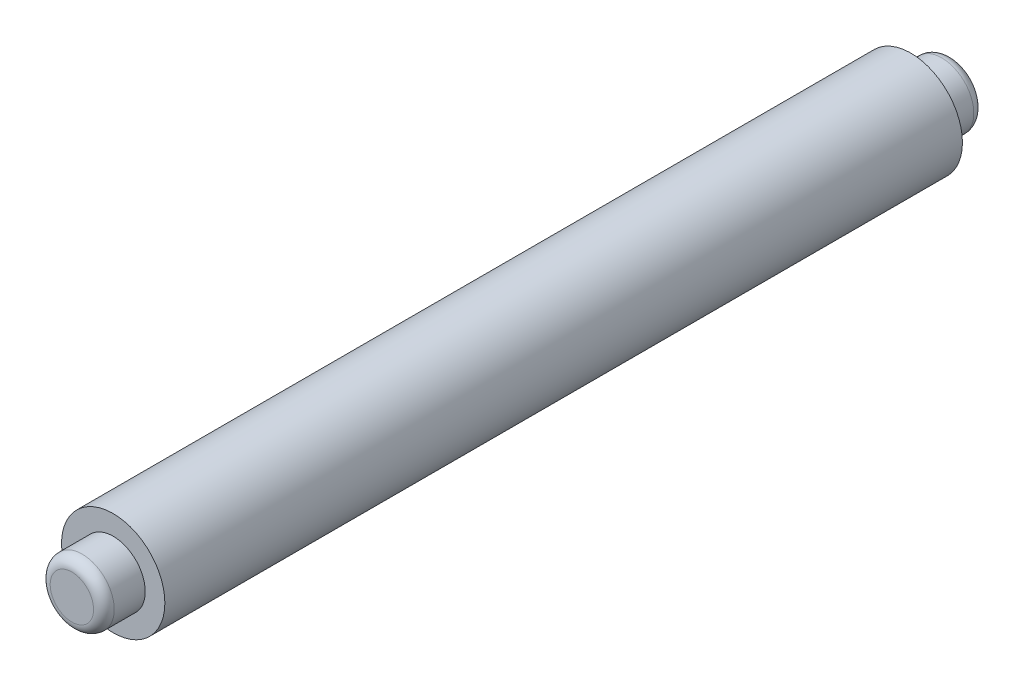
from build123d import *

# Parameters (mm, degrees)
SKETCH1_R           = 2.5
BOSS_EXTRUDE1_DEPTH = 38.61
SKETCH2_R           = 1.55
BOSS_EXTRUDE2_DEPTH = 2
FILLET1_R           = 0.5
BOSS_EXTRUDE3_START = 2
SKETCH3_R           = 1.55
BOSS_EXTRUDE3_DEPTH = 2
FILLET2_R           = 0.5


with BuildPart() as part:
    # Sketch1 → Boss-Extrude1 (new body)
    with BuildSketch(Plane.XY):
        with Locations((-23.972717512, -13.578911998)):
            Circle(SKETCH1_R)
    extrude(amount=BOSS_EXTRUDE1_DEPTH)

    # Sketch2 → Boss-Extrude2 (add)
    with BuildSketch(Plane.XY.offset(38.61)):
        with Locations((-23.972717512, -13.578911998)):
            Circle(SKETCH2_R)
    extrude(amount=BOSS_EXTRUDE2_DEPTH)

    # Fillet1
    fillet1_edges = [part.edges().sort_by_distance(p)[0] for p in [
        (-25.522717512, -13.578911998, 40.61),
    ]]
    fillet(fillet1_edges, radius=FILLET1_R)

    # Sketch3 → Boss-Extrude3 (add)
    with BuildSketch(Plane(origin=(0, 0, 0), x_dir=(-1, 0, 0), z_dir=(0, 0, -1)).offset(BOSS_EXTRUDE3_START)):
        with Locations(Location((23.972717512, -13.578911998, 0), (0, 0, 180))):
            Circle(SKETCH3_R)
    extrude(amount=-BOSS_EXTRUDE3_DEPTH)

    # Fillet2
    fillet2_edges = [part.edges().sort_by_distance(p)[0] for p in [
        (-25.522717512, -13.578911998, -2),
    ]]
    fillet(fillet2_edges, radius=FILLET2_R)


solid = part.part
